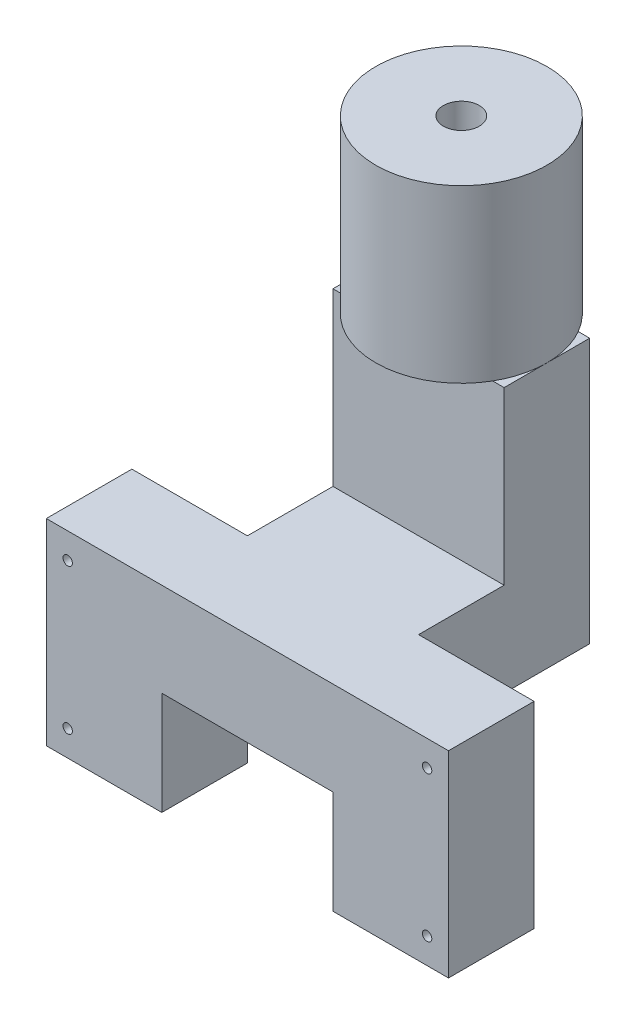
from build123d import *

# Parameters (mm, degrees)
ESQUISSE1_W               = 47
ESQUISSE1_H               = 23
BOSS_EXTRU_1_DEPTH        = 10
TROU_TARAUD_M1_4X0_32_D   = 1.1
ESQUISSE5_W               = 20
ESQUISSE5_H               = 15
ENL_V_MAT_EXTRU_1_DEPTH   = 10
ESQUISSE6_W               = 20
ESQUISSE6_H               = 10.927419914
BOSS_EXTRU_2_DEPTH        = 20
ESQUISSE9_W               = 20
ESQUISSE9_H               = 10
BOSS_EXTRU_5_DEPTH        = 20
ESQUISSE10_R              = 10
BOSS_EXTRU_6_DEPTH        = 20
TROU_TARAUD_M5X0_81_D     = 4.2
TROU_TARAUD_M5X0_81_DEPTH = 10
TROU_TARAUD_M5X0_81_TIP   = 1.2618073


with BuildPart() as part:
    # Esquisse1 → Boss.-Extru.1 (new body)
    with BuildSketch(Plane.XY):
        Rectangle(ESQUISSE1_W, ESQUISSE1_H)
    extrude(amount=BOSS_EXTRU_1_DEPTH)

    # Trou taraudé M1.4x0.32 (through all)
    with Locations(Plane(origin=(-21, 8.5, 10), x_dir=(1, 0, 0), z_dir=(0, 0, 1))):
        with Locations((0, 0), (0, -17), (42, -17), (42, 0)):
            Hole(TROU_TARAUD_M1_4X0_32_D / 2)

    # Esquisse5 → Enlèv. mat.-Extru.1 (cut)
    with BuildSketch(Plane.XY.offset(10)):
        with Locations((0, -6.927419914)):
            Rectangle(ESQUISSE5_W, ESQUISSE5_H)
    extrude(amount=-ENL_V_MAT_EXTRU_1_DEPTH, mode=Mode.SUBTRACT)

    # Esquisse6 → Boss.-Extru.2 (add)
    with BuildSketch(Plane(origin=(0, 0, 0), x_dir=(-1, 0, 0), z_dir=(0, 0, -1))):
        with Locations((0, 6.036290043)):
            Rectangle(ESQUISSE6_W, ESQUISSE6_H)
    extrude(amount=BOSS_EXTRU_2_DEPTH)

    # Esquisse9 → Boss.-Extru.5 (add)
    with BuildSketch(Plane(origin=(0, 11.5, 0), x_dir=(1, 0, 0), z_dir=(0, 1, 0))):
        with Locations((0, 15)):
            Rectangle(ESQUISSE9_W, ESQUISSE9_H)
    extrude(amount=BOSS_EXTRU_5_DEPTH)

    # Esquisse10 → Boss.-Extru.6 (add)
    with BuildSketch(Plane(origin=(0, 31.5, 0), x_dir=(1, 0, 0), z_dir=(0, 1, 0))):
        with Locations(Location((0, 15, 0), (0, 0, 30))):
            Circle(ESQUISSE10_R)
    extrude(amount=BOSS_EXTRU_6_DEPTH)

    # Trou taraudé M5x0.81
    with Locations(Plane(origin=(0, 51.5, -15), x_dir=(0, 0, 1), z_dir=(0, 1, 0))):
        with Locations((0, 0)):
            Hole(TROU_TARAUD_M5X0_81_D / 2, depth=TROU_TARAUD_M5X0_81_DEPTH)
            with Locations((0, 0, -(TROU_TARAUD_M5X0_81_DEPTH + TROU_TARAUD_M5X0_81_TIP / 2))):  # 118° drill point
                Cone(0, TROU_TARAUD_M5X0_81_D / 2, TROU_TARAUD_M5X0_81_TIP, mode=Mode.SUBTRACT)


solid = part.part
